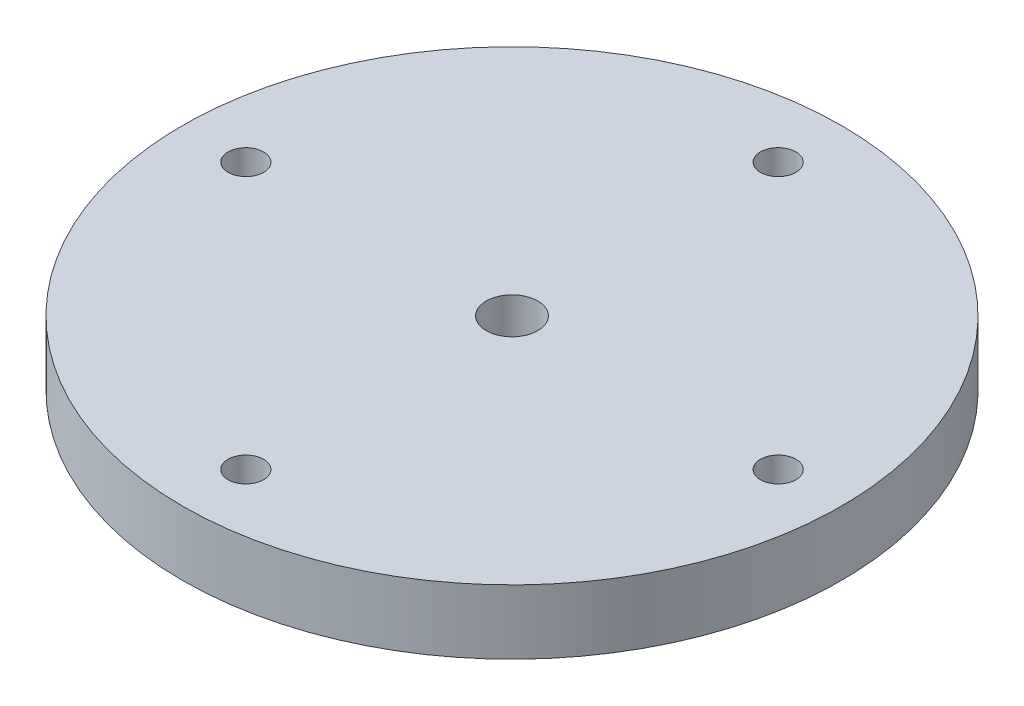
from build123d import *

# Parameters (mm, degrees)
SKETCH1_R               = 32.5
BOSS_EXTRUDE1_DEPTH     = 6.35
ESQUISSE1_R             = 2.54
ENL_V_MAT_EXTRU_1_DEPTH = 47.398518295
ESQUISSE3_R             = 1.75
ENL_V_MAT_EXTRU_2_DEPTH = 47.398518295


with BuildPart() as part:
    # Sketch1 → Boss-Extrude1 (new body)
    with BuildSketch(Plane(origin=(0, 0, 0), x_dir=(1, 0, 0), z_dir=(0, 1, 0))):
        with Locations(Location((0, 0, 0), (0, 0, 270))):
            Circle(SKETCH1_R)
    extrude(amount=BOSS_EXTRUDE1_DEPTH)

    # Esquisse1 → Enlèv. mat.-Extru.1 (cut, through all)
    with BuildSketch(Plane(origin=(0, 6.35, 0), x_dir=(1, 0, 0), z_dir=(0, 1, 0))):
        with Locations(Location((0, 0, 0), (0, 0, 270))):
            Circle(ESQUISSE1_R)
    extrude(amount=-ENL_V_MAT_EXTRU_1_DEPTH, mode=Mode.SUBTRACT)

    # Esquisse3 → Enlèv. mat.-Extru.2 (cut, through all)
    with BuildSketch(Plane(origin=(0, 6.35, 0), x_dir=(1, 0, 0), z_dir=(0, 1, 0))):
        with Locations(Location((0, -26.25, 0), (0, 0, 270))):
            Circle(ESQUISSE3_R)
        with Locations(Location((26.25, 0, 0), (0, 0, 270))):
            Circle(ESQUISSE3_R)
        with Locations(Location((0, 26.25, 0), (0, 0, 270))):
            Circle(ESQUISSE3_R)
        with Locations(Location((-26.25, 0, 0), (0, 0, 270))):
            Circle(ESQUISSE3_R)
    extrude(amount=-ENL_V_MAT_EXTRU_2_DEPTH, mode=Mode.SUBTRACT)


solid = part.part
